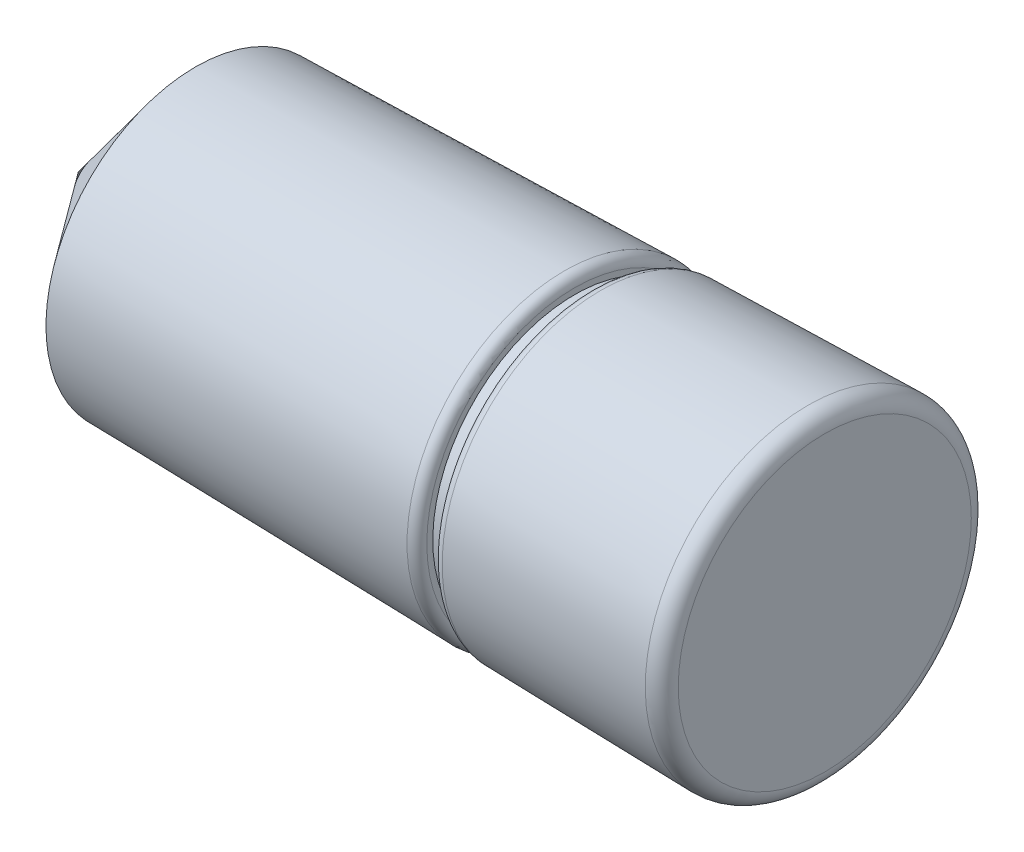
from build123d import *


with BuildPart() as part:
    # Sketch1 → Revolve1 (revolve)
    with BuildSketch(Plane.XY, mode=Mode.PRIVATE) as revolve1_sk:
        with BuildLine():
            Line((534.155979739, 153.717367707), (461.543520528, 153.713036963))
            Line((461.543520528, 153.713036963), (472.95353958, 139.157140689))
            Line((472.95353958, 139.157140689), (508.84884605, 138.386024717))
            ThreePointArc((508.84884605, 138.386024717), (509.535550508, 138.657591499), (509.82180328, 139.338305007))
            Line((509.82180328, 139.338305007), (509.82180328, 139.918520047))
            Line((509.82180328, 139.918520047), (511.40930328, 139.918520047))
            Line((511.40930328, 139.918520047), (511.40930328, 139.263277858))
            ThreePointArc((511.40930328, 139.263277858), (511.681089771, 138.597030629), (512.34134605, 138.310997567))
            Line((512.34134605, 138.310997567), (532.534384355, 137.877203406))
            ThreePointArc((532.534384355, 137.877203406), (533.678891786, 138.329814709), (534.155979739, 139.464337223))
            Line((534.155979739, 139.464337223), (534.155979739, 153.717367707))
        make_face()
    revolve(revolve1_sk.sketch.rotate(Axis((534.155979739, 153.717367707, 0), (-0.9999999982214233, -5.96418779812159e-05, 0)), 180), axis=Axis((534.155979739, 153.717367707, 0), (-0.9999999982214233, -5.96418779812159e-05, 0)))


solid = part.part
